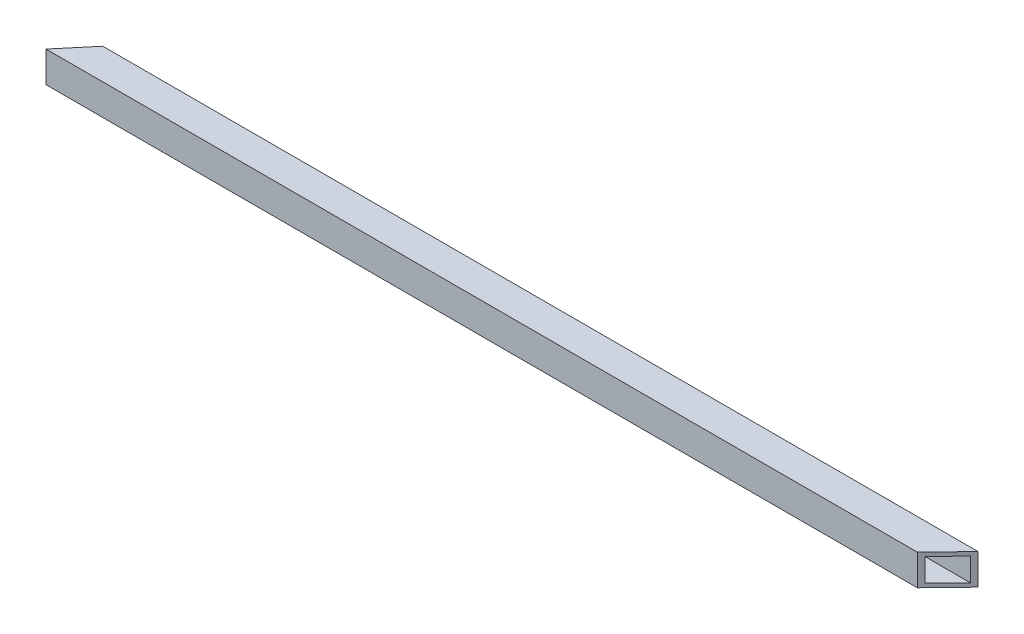
from build123d import *

# Parameters (mm, degrees)
SKETCH1_W               = 12.7
SKETCH1_H               = 12.7
SKETCH1_W_2             = 9.525
SKETCH1_H_2             = 9.525
BOSS_EXTRUDE1_DEPTH     = 185.42
CUT_EXTRUDE1_DEPTH      = 186.637338378
CUT_EXTRUDE1_DEPTH_BACK = 186.637338378
CUT_EXTRUDE2_DEPTH      = 186.637338378
CUT_EXTRUDE2_DEPTH_BACK = 186.637338378


with BuildPart() as part:
    # Sketch1 → Boss-Extrude1 (new, symmetric)
    with BuildSketch(Plane(origin=(0, 0, 0), x_dir=(0, 0, -1), z_dir=(1, 0, 0))):
        Rectangle(SKETCH1_W, SKETCH1_H)
        Rectangle(SKETCH1_W_2, SKETCH1_H_2, mode=Mode.SUBTRACT)
    extrude(amount=BOSS_EXTRUDE1_DEPTH, both=True)

    # Sketch2 → Cut-Extrude1 (cut, two sides: drawn at the far end of the back side and taken through both)
    with BuildSketch(Plane(origin=(0, 0, 0), x_dir=(1, 0, 0), z_dir=(0, 1, 0)).offset(-CUT_EXTRUDE1_DEPTH_BACK)):
        Polygon((-185.42, -6.35), (-174.250456919, 6.961343094), (-183.078216502, 14.368712905), (-194.247759583, 1.057369811), align=None)
    extrude(amount=CUT_EXTRUDE1_DEPTH + CUT_EXTRUDE1_DEPTH_BACK, mode=Mode.SUBTRACT)

    # Sketch3 → Cut-Extrude2 (cut, two sides: drawn at the far end of the back side and taken through both)
    with BuildSketch(Plane(origin=(0, 0, 0), x_dir=(1, 0, 0), z_dir=(0, 1, 0)).offset(-CUT_EXTRUDE2_DEPTH_BACK)):
        Polygon((185.42, 6.35), (173.150938826, -6.35), (185.42, -6.35), align=None)
    extrude(amount=CUT_EXTRUDE2_DEPTH + CUT_EXTRUDE2_DEPTH_BACK, mode=Mode.SUBTRACT)


solid = part.part
